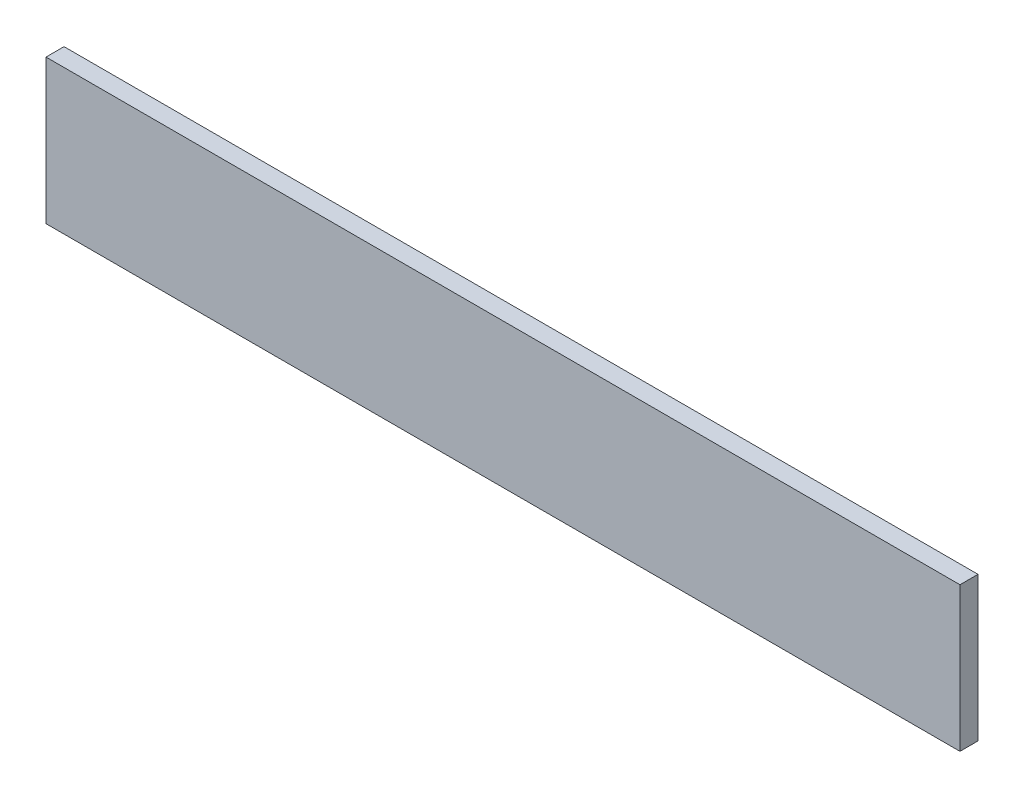
from build123d import *

# Parameters (mm, degrees)
SKETCH1_W           = 241.3
SKETCH1_H           = 38.1
BOSS_EXTRUDE1_DEPTH = 4.7625


with BuildPart() as part:
    # Sketch1 → Boss-Extrude1 (new body)
    with BuildSketch(Plane.XY):
        Rectangle(SKETCH1_W, SKETCH1_H)
    extrude(amount=BOSS_EXTRUDE1_DEPTH)


solid = part.part
